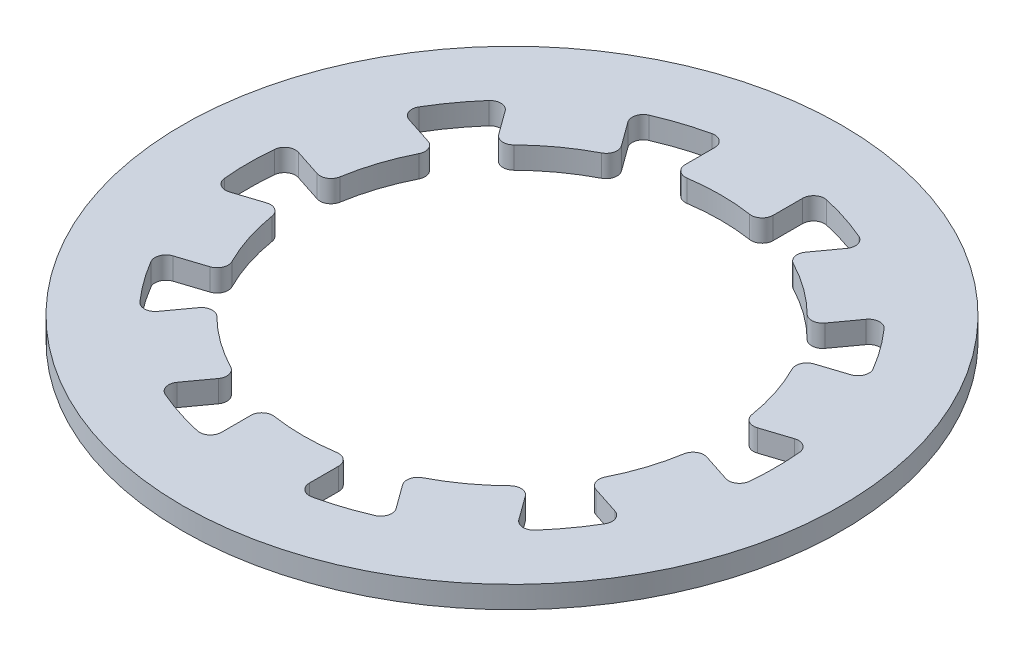
from build123d import *

# Parameters (mm, degrees)
SKETCH1_R           = 15
BOSS_EXTRUDE1_DEPTH = 1


with BuildPart() as part:
    # Sketch1 → Boss-Extrude1 (new body)
    with BuildSketch(Plane(origin=(0, 0, 0), x_dir=(1, 0, 0), z_dir=(0, 1, 0))):
        with Locations(Location((0, 0, 0), (0, 0, 270))):
            Circle(SKETCH1_R)
        with BuildLine():
            Line((-2, 11.22497216), (-2, 9.886859967))
            ThreePointArc((-2, 9.886859967), (-1.82596012, 9.507716194), (-1.425, 9.392516968))
            ThreePointArc((-1.425, 9.392516968), (0, 9.5), (1.425, 9.392516968))
            ThreePointArc((1.425, 9.392516968), (1.82596012, 9.507716194), (2, 9.886859967))
            Line((2, 9.886859967), (2, 11.22497216))
            ThreePointArc((2, 11.22497216), (2.187228379, 11.615066909), (2.608695652, 11.713014428))
            ThreePointArc((2.608695652, 11.713014428), (3.708203932, 11.412678196), (4.774258025, 11.00938056))
            ThreePointArc((4.774258025, 11.00938056), (5.057660104, 10.682407105), (4.979839104, 10.256763744))
            Line((4.979839104, 10.256763744), (4.193316491, 9.174208239))
            ThreePointArc((4.193316491, 9.174208239), (4.111262594, 8.765176409), (4.367933739, 8.436299832))
            ThreePointArc((4.367933739, 8.436299832), (5.583959897, 7.685661447), (6.673632173, 6.761111863))
            ThreePointArc((6.673632173, 6.761111863), (7.06572813, 6.618631549), (7.429384469, 6.823067229))
            Line((7.429384469, 6.823067229), (8.215907082, 7.905622735))
            ThreePointArc((8.215907082, 7.905622735), (8.596669963, 8.111165936), (8.995216257, 7.942674896))
            ThreePointArc((8.995216257, 7.942674896), (9.708203932, 7.053423028), (10.333607408, 6.100537513))
            ThreePointArc((10.333607408, 6.100537513), (10.370694331, 5.669430868), (10.05754893, 5.370820192))
            Line((10.05754893, 5.370820192), (8.784928608, 4.957320783))
            ThreePointArc((8.784928608, 4.957320783), (8.478122734, 4.674637153), (8.49246525, 4.257702899))
            ThreePointArc((8.49246525, 4.257702899), (9.035036905, 2.935661447), (9.373163684, 1.547191827))
            ThreePointArc((9.373163684, 1.547191827), (9.60662815, 1.201454611), (10.020996586, 1.153094718))
            Line((10.020996586, 1.153094718), (11.293616907, 1.566594126))
            ThreePointArc((11.293616907, 1.566594126), (11.722475811, 1.509075263), (11.945869987, 1.138503515))
            ThreePointArc((11.945869987, 1.138503515), (12, 0), (11.945869987, -1.138503515))
            ThreePointArc((11.945869987, -1.138503515), (11.722475811, -1.509075263), (11.293616907, -1.566594126))
            Line((11.293616907, -1.566594126), (10.020996586, -1.153094718))
            ThreePointArc((10.020996586, -1.153094718), (9.60662815, -1.201454611), (9.373163684, -1.547191827))
            ThreePointArc((9.373163684, -1.547191827), (9.035036905, -2.935661447), (8.49246525, -4.257702899))
            ThreePointArc((8.49246525, -4.257702899), (8.478122734, -4.674637153), (8.784928608, -4.957320783))
            Line((8.784928608, -4.957320783), (10.05754893, -5.370820192))
            ThreePointArc((10.05754893, -5.370820192), (10.370694331, -5.669430868), (10.333607408, -6.100537513))
            ThreePointArc((10.333607408, -6.100537513), (9.708203932, -7.053423028), (8.995216257, -7.942674896))
            ThreePointArc((8.995216257, -7.942674896), (8.596669963, -8.111165936), (8.215907082, -7.905622735))
            Line((8.215907082, -7.905622735), (7.429384469, -6.823067229))
            ThreePointArc((7.429384469, -6.823067229), (7.06572813, -6.618631549), (6.673632173, -6.761111863))
            ThreePointArc((6.673632173, -6.761111863), (5.583959897, -7.685661447), (4.367933739, -8.436299832))
            ThreePointArc((4.367933739, -8.436299832), (4.111262594, -8.765176409), (4.193316491, -9.174208239))
            Line((4.193316491, -9.174208239), (4.979839104, -10.256763744))
            ThreePointArc((4.979839104, -10.256763744), (5.057660104, -10.682407105), (4.774258025, -11.00938056))
            ThreePointArc((4.774258025, -11.00938056), (3.708203932, -11.412678196), (2.608695652, -11.713014428))
            ThreePointArc((2.608695652, -11.713014428), (2.187228379, -11.615066909), (2, -11.22497216))
            Line((2, -11.22497216), (2, -9.886859967))
            ThreePointArc((2, -9.886859967), (1.82596012, -9.507716194), (1.425, -9.392516968))
            ThreePointArc((1.425, -9.392516968), (0, -9.5), (-1.425, -9.392516968))
            ThreePointArc((-1.425, -9.392516968), (-1.82596012, -9.507716194), (-2, -9.886859967))
            Line((-2, -9.886859967), (-2, -11.22497216))
            ThreePointArc((-2, -11.22497216), (-2.187228379, -11.615066909), (-2.608695652, -11.713014428))
            ThreePointArc((-2.608695652, -11.713014428), (-3.708203932, -11.412678196), (-4.774258025, -11.00938056))
            ThreePointArc((-4.774258025, -11.00938056), (-5.057660104, -10.682407105), (-4.979839104, -10.256763744))
            Line((-4.979839104, -10.256763744), (-4.193316491, -9.174208239))
            ThreePointArc((-4.193316491, -9.174208239), (-4.111262594, -8.765176409), (-4.367933739, -8.436299832))
            ThreePointArc((-4.367933739, -8.436299832), (-5.583959897, -7.685661447), (-6.673632173, -6.761111863))
            ThreePointArc((-6.673632173, -6.761111863), (-7.06572813, -6.618631549), (-7.429384469, -6.823067229))
            Line((-7.429384469, -6.823067229), (-8.215907082, -7.905622735))
            ThreePointArc((-8.215907082, -7.905622735), (-8.596669963, -8.111165936), (-8.995216257, -7.942674896))
            ThreePointArc((-8.995216257, -7.942674896), (-9.708203932, -7.053423028), (-10.333607408, -6.100537513))
            ThreePointArc((-10.333607408, -6.100537513), (-10.370694331, -5.669430868), (-10.05754893, -5.370820192))
            Line((-10.05754893, -5.370820192), (-8.784928608, -4.957320783))
            ThreePointArc((-8.784928608, -4.957320783), (-8.478122734, -4.674637153), (-8.49246525, -4.257702899))
            ThreePointArc((-8.49246525, -4.257702899), (-9.035036905, -2.935661447), (-9.373163684, -1.547191827))
            ThreePointArc((-9.373163684, -1.547191827), (-9.60662815, -1.201454611), (-10.020996586, -1.153094718))
            Line((-10.020996586, -1.153094718), (-11.293616907, -1.566594126))
            ThreePointArc((-11.293616907, -1.566594126), (-11.722475811, -1.509075263), (-11.945869987, -1.138503515))
            ThreePointArc((-11.945869987, -1.138503515), (-12, 0), (-11.945869987, 1.138503515))
            ThreePointArc((-11.945869987, 1.138503515), (-11.722475811, 1.509075263), (-11.293616907, 1.566594126))
            Line((-11.293616907, 1.566594126), (-10.020996586, 1.153094718))
            ThreePointArc((-10.020996586, 1.153094718), (-9.60662815, 1.201454611), (-9.373163684, 1.547191827))
            ThreePointArc((-9.373163684, 1.547191827), (-9.035036905, 2.935661447), (-8.49246525, 4.257702899))
            ThreePointArc((-8.49246525, 4.257702899), (-8.478122734, 4.674637153), (-8.784928608, 4.957320783))
            Line((-8.784928608, 4.957320783), (-10.05754893, 5.370820192))
            ThreePointArc((-10.05754893, 5.370820192), (-10.370694331, 5.669430868), (-10.333607408, 6.100537513))
            ThreePointArc((-10.333607408, 6.100537513), (-9.708203932, 7.053423028), (-8.995216257, 7.942674896))
            ThreePointArc((-8.995216257, 7.942674896), (-8.596669963, 8.111165936), (-8.215907082, 7.905622735))
            Line((-8.215907082, 7.905622735), (-7.429384469, 6.823067229))
            ThreePointArc((-7.429384469, 6.823067229), (-7.06572813, 6.618631549), (-6.673632173, 6.761111863))
            ThreePointArc((-6.673632173, 6.761111863), (-5.583959897, 7.685661447), (-4.367933739, 8.436299832))
            ThreePointArc((-4.367933739, 8.436299832), (-4.111262594, 8.765176409), (-4.193316491, 9.174208239))
            Line((-4.193316491, 9.174208239), (-4.979839104, 10.256763744))
            ThreePointArc((-4.979839104, 10.256763744), (-5.057660104, 10.682407105), (-4.774258025, 11.00938056))
            ThreePointArc((-4.774258025, 11.00938056), (-3.708203932, 11.412678196), (-2.608695652, 11.713014428))
            ThreePointArc((-2.608695652, 11.713014428), (-2.187228379, 11.615066909), (-2, 11.22497216))
        make_face(mode=Mode.SUBTRACT)
    extrude(amount=BOSS_EXTRUDE1_DEPTH)


solid = part.part
